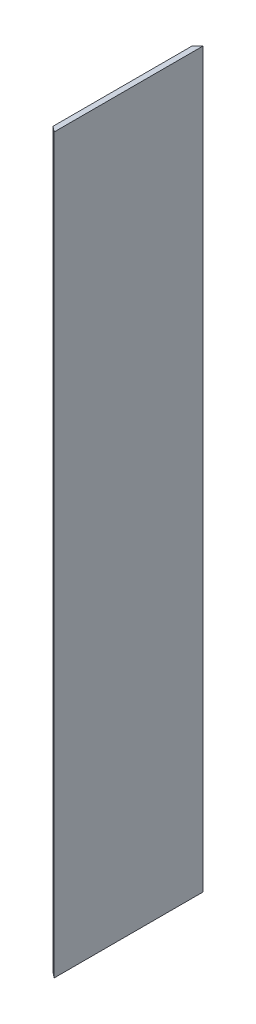
from build123d import *

# Parameters (mm, degrees)
EXTRUDE_1_DEPTH = 533


with BuildPart() as part:
    # Эскиз1 → Вытянуть1 (new body)
    with BuildSketch(Plane(origin=(0, 0, 0), x_dir=(1, 0, 0), z_dir=(0, 1, 0))):
        Polygon((1.026379046, -3.481753381), (1.026379046, -104.641612003), (5.026379046, -107.838799799), (5.026379046, 0.491200201), align=None)
    extrude(amount=EXTRUDE_1_DEPTH)


solid = part.part
